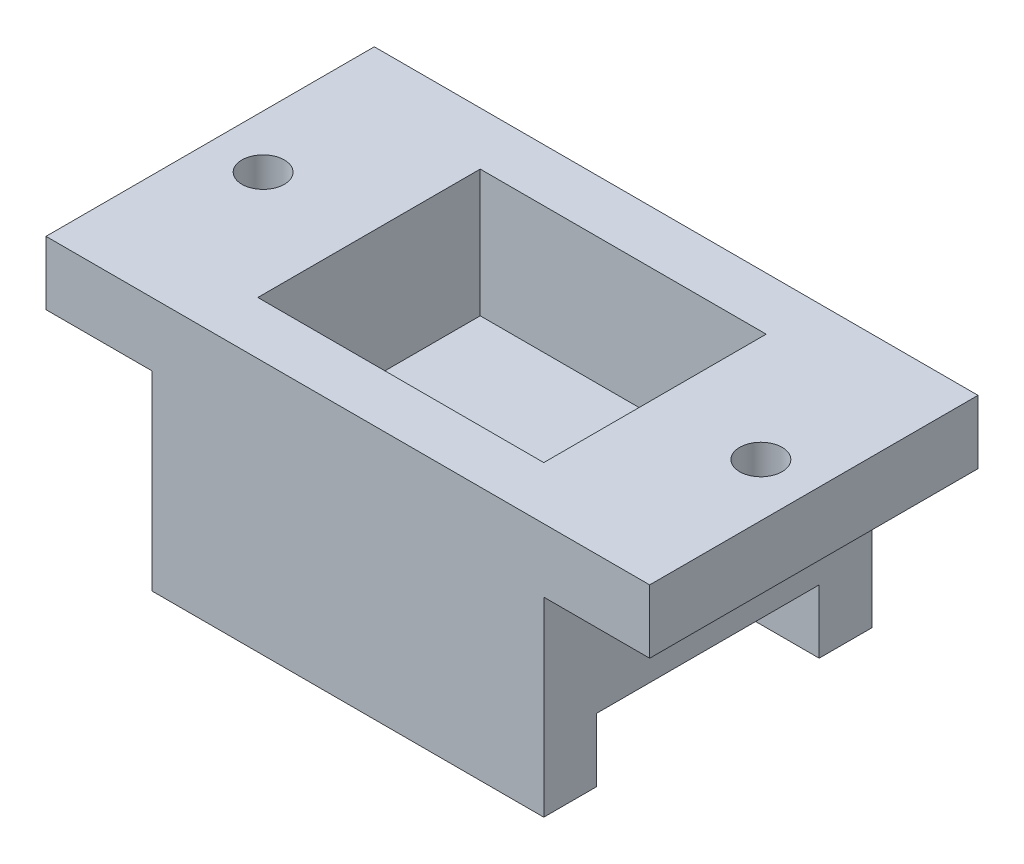
from build123d import *

# Parameters (mm, degrees)
SKETCH2_W           = 18.5
SKETCH2_H           = 15.5
BOSS_EXTRUDE1_DEPTH = 11
SKETCH3_W           = 18.5
SKETCH3_H           = 15.5
BOSS_EXTRUDE2_DEPTH = 3
SKETCH4_W           = 13.5
SKETCH4_H           = 10.5
CUT_EXTRUDE1_DEPTH  = 6
SKETCH5_W           = 3
SKETCH5_H           = 10.5
CUT_EXTRUDE2_DEPTH  = 26
SKETCH10_W          = 18.5
SKETCH10_H          = 5
CUT_EXTRUDE3_DEPTH  = 26
SKETCH11_W          = 15.5
SKETCH11_H          = 3
BOSS_EXTRUDE3_DEPTH = 5
SKETCH13_W          = 18.5
SKETCH13_H          = 2.498768597
BOSS_EXTRUDE4_DEPTH = 3
SKETCH14_W          = 15.5
SKETCH14_H          = 3
BOSS_EXTRUDE6_DEPTH = 5
SKETCH16_R          = 1
CUT_EXTRUDE5_DEPTH  = 5


with BuildPart() as part:
    # Sketch2 → Boss-Extrude1 (new body)
    with BuildSketch(Plane(origin=(0, 0, 0), x_dir=(1, 0, 0), z_dir=(0, 1, 0))):
        with Locations((-3.622916667, -0.966666667)):
            Rectangle(SKETCH2_W, SKETCH2_H)
    extrude(amount=BOSS_EXTRUDE1_DEPTH)

    # Sketch3 → Boss-Extrude2 (add)
    with BuildSketch(Plane(origin=(0, 11, 0), x_dir=(1, 0, 0), z_dir=(0, 1, 0))):
        with Locations((-3.622916667, -0.966666667)):
            Rectangle(SKETCH3_W, SKETCH3_H)
    extrude(amount=BOSS_EXTRUDE2_DEPTH)

    # Sketch4 → Cut-Extrude1 (cut)
    with BuildSketch(Plane(origin=(0, 14, 0), x_dir=(1, 0, 0), z_dir=(0, 1, 0))):
        with Locations((-3.622916667, -0.966666667)):
            Rectangle(SKETCH4_W, SKETCH4_H)
    extrude(amount=-CUT_EXTRUDE1_DEPTH, mode=Mode.SUBTRACT)

    # Sketch5 → Cut-Extrude2 (cut)
    with BuildSketch(Plane(origin=(0, 8, 0), x_dir=(1, 0, 0), z_dir=(0, 1, 0))):
        with Locations((1.627083333, -0.966666667)):
            Rectangle(SKETCH5_W, SKETCH5_H)
    extrude(amount=-CUT_EXTRUDE2_DEPTH, mode=Mode.SUBTRACT)

    # Sketch10 → Cut-Extrude3 (cut)
    with BuildSketch(Plane.XY.offset(8.716666667)):
        with Locations((-3.622916667, 2.5)):
            Rectangle(SKETCH10_W, SKETCH10_H)
    extrude(amount=-CUT_EXTRUDE3_DEPTH, mode=Mode.SUBTRACT)

    # Sketch11 → Boss-Extrude3 (add)
    with BuildSketch(Plane(origin=(5.627083333, 0, 0), x_dir=(0, 0, -1), z_dir=(1, 0, 0))):
        with Locations((-0.966666667, 12.5)):
            Rectangle(SKETCH11_W, SKETCH11_H)
    extrude(amount=BOSS_EXTRUDE3_DEPTH)

    # Sketch13 → Boss-Extrude4 (add)
    with BuildSketch(Plane.XZ.offset(-5)):
        Polygon((5.627083333, 6.217898069), (5.627083333, 8.716666667), (-12.872916667, 8.716666667), (-12.872916667, 6.217898069), (0.127083333, 6.217898069), align=None)
        Polygon((0.127083333, 6.217898069), (-12.872916667, 6.217898069), (-12.872916667, -4.283333333), (0.127083333, -4.283333333), (0.127083333, 6.216666667), align=None)
        with Locations((-3.622916667, -5.533949035)):
            Rectangle(SKETCH13_W, SKETCH13_H)
    extrude(amount=BOSS_EXTRUDE4_DEPTH)

    # Sketch14 → Boss-Extrude6 (add)
    with BuildSketch(Plane.ZY.offset(12.872916667)):
        with Locations((0.966666667, 12.5)):
            Rectangle(SKETCH14_W, SKETCH14_H)
    extrude(amount=BOSS_EXTRUDE6_DEPTH)

    # Sketch16 → Cut-Extrude5 (cut)
    with BuildSketch(Plane(origin=(0, 14, 0), x_dir=(1, 0, 0), z_dir=(0, 1, 0))):
        with Locations(Location((-15.372916667, -0.966666667, 0), (0, 0, 270))):
            Circle(SKETCH16_R)
        with Locations(Location((8.127083333, -0.966666667, 0), (0, 0, 270))):
            Circle(SKETCH16_R)
    extrude(amount=-CUT_EXTRUDE5_DEPTH, mode=Mode.SUBTRACT)


solid = part.part
